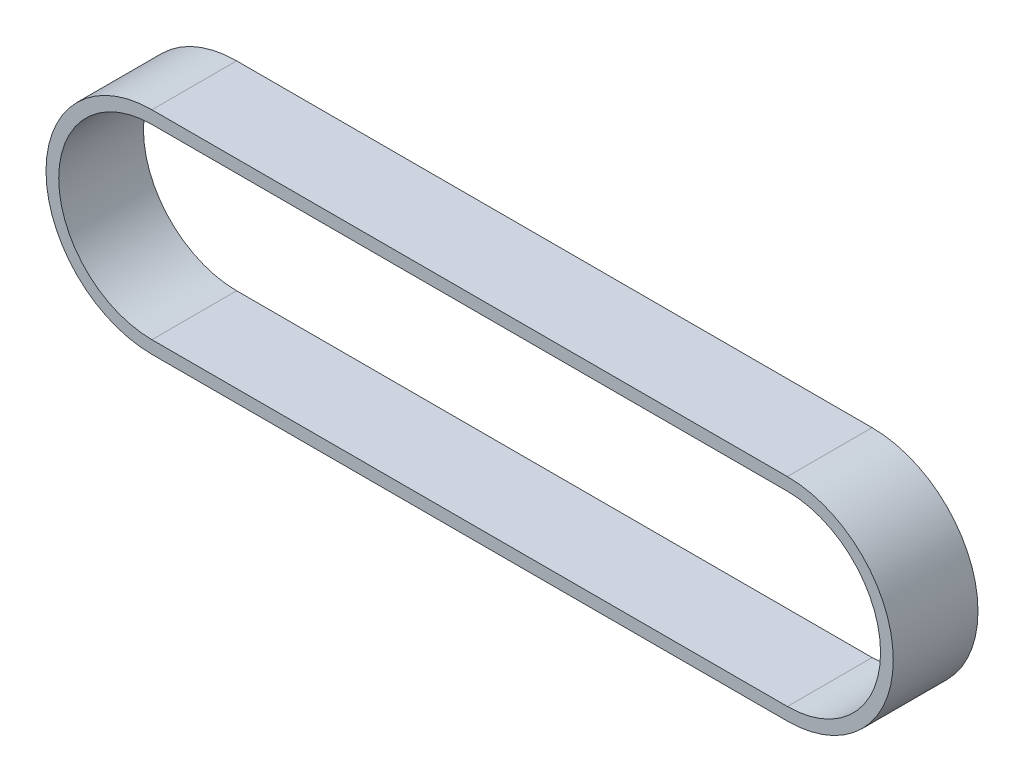
from build123d import *

# Parameters (mm, degrees)
EXTRUDE_THIN1_DEPTH = 20


with BuildPart() as part:
    # Sketch2 → Extrude-Thin1 (new, symmetric)
    with BuildSketch(Plane.XY):
        with BuildLine():
            Line((-300.007045027, 49.957711456), (-0.007048008, 49.999999503))
            ThreePointArc((-0.007048008, 49.999999503), (49.999999503, 0.007048008), (0.007048008, -49.999999503))
            Line((0.007048008, -49.999999503), (-299.992949012, -50.04228755))
            ThreePointArc((-299.992949012, -50.04228755), (-349.999996523, -0.049336055), (-300.007045027, 49.957711456))
        make_face()
        with BuildLine():
            Line((-300.006199266, 43.957711516), (-0.006202247, 43.999999563))
            ThreePointArc((-0.006202247, 43.999999563), (43.999999563, 0.006202247), (0.006202247, -43.999999563))
            Line((0.006202247, -43.999999563), (-299.993794773, -44.04228761))
            ThreePointArc((-299.993794773, -44.04228761), (-343.999996582, -0.048490294), (-300.006199266, 43.957711516))
        make_face(mode=Mode.SUBTRACT)
    extrude(amount=EXTRUDE_THIN1_DEPTH, both=True)


solid = part.part
